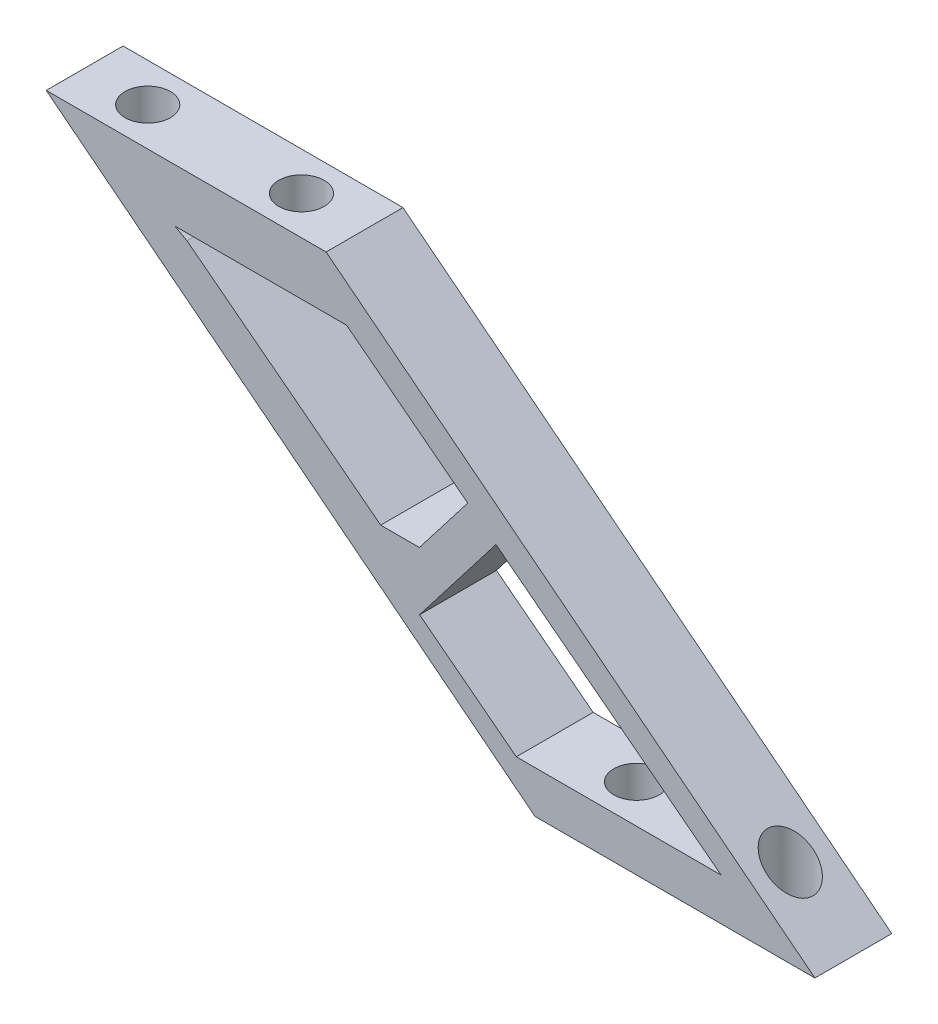
from build123d import *

# Parameters (mm, degrees)
BOSS_EXTRUDE1_DEPTH = 5.08
SKETCH2_R           = 1.5
CUT_EXTRUDE1_DEPTH  = 5.08
SKETCH3_R           = 1.5
CUT_EXTRUDE2_DEPTH  = 6.604


with BuildPart() as part:
    # Sketch1 → Boss-Extrude1 (new body)
    with BuildSketch(Plane.XY):
        Polygon((-22.656445993, 16.461324042), (-4.159581882, 16.461324042), (28.143554007, -8.938675958), (9.646689895, -8.938675958), align=None)
        Polygon((-13.356685139, 12.508658791), (-0.553226603, 2.631705063), (2.007465105, 2.631705063), (5.201047175, 6.771533672), (-2.806028737, 12.948420804), (-14.161473962, 12.948420804), align=None, mode=Mode.SUBTRACT)
        Polygon((2.017499691, -1.213937924), (8.409364086, -6.144804743), (21.944448825, -6.144804743), (7.067180743, 5.33194492), align=None, mode=Mode.SUBTRACT)
    extrude(amount=BOSS_EXTRUDE1_DEPTH)

    # Sketch2 → Cut-Extrude1 (cut)
    with BuildSketch(Plane(origin=(0, 16.461324042, 0), x_dir=(1, 0, 0), z_dir=(0, 1, 0))):
        with Locations(Location((-18.488013937, -2.54, 0), (0, 0, 270))):
            Circle(SKETCH2_R)
        with Locations(Location((-8.328013937, -2.54, 0), (0, 0, 270))):
            Circle(SKETCH2_R)
    extrude(amount=-CUT_EXTRUDE1_DEPTH, mode=Mode.SUBTRACT)

    # Sketch3 → Cut-Extrude2 (cut)
    with BuildSketch(Plane(origin=(0, -8.938675958, 0), x_dir=(-1, 0, 0), z_dir=(0, -1, 0))):
        with Locations(Location((-23.975121951, -2.54, 0), (0, 0, 180))):
            Circle(SKETCH3_R)
        with Locations(Location((-13.815121951, -2.54, 0), (0, 0, 180))):
            Circle(SKETCH3_R)
    extrude(amount=-CUT_EXTRUDE2_DEPTH, mode=Mode.SUBTRACT)


solid = part.part
